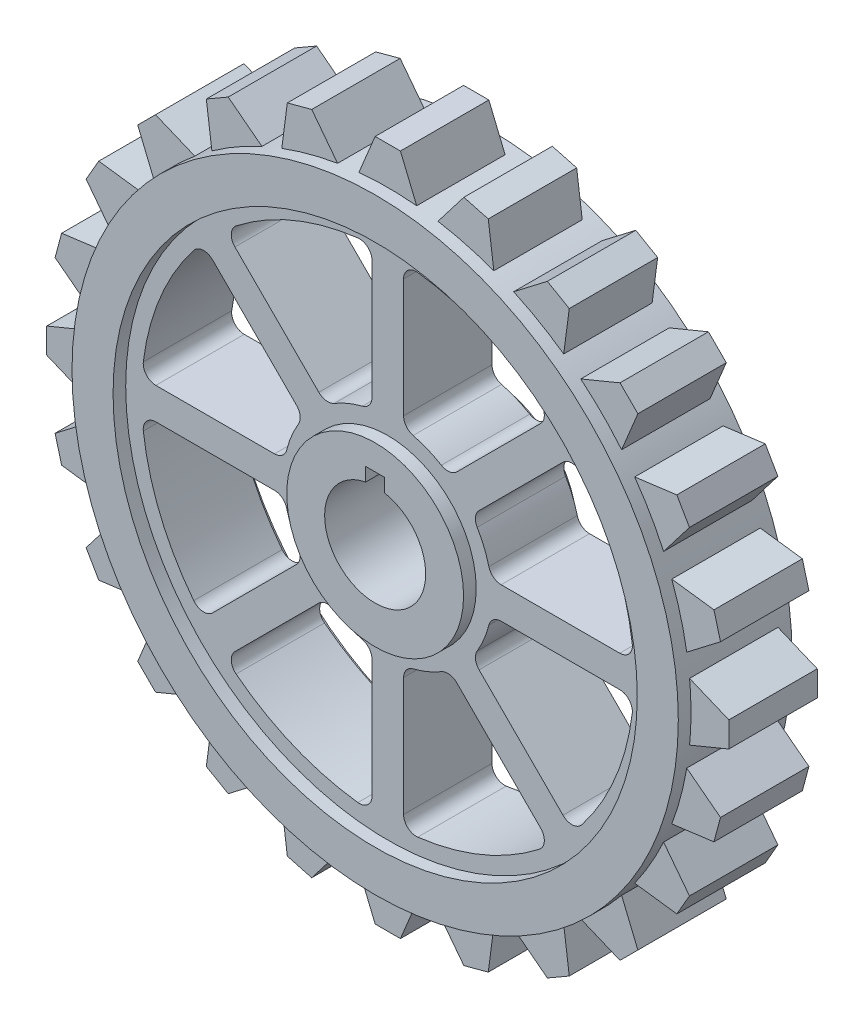
from build123d import *

# Parameters (mm, degrees)
SKETCH1_R           = 48
BOSS_EXTRUDE1_DEPTH = 9
SKETCH2_R           = 41.5
SKETCH2_R_2         = 14
CUT_EXTRUDE1_DEPTH  = 2
CUT_EXTRUDE2_DEPTH  = 70.742383097
CIRPATTERN2_COUNT   = 8
BOSS_EXTRUDE2_DEPTH = 7
CIRPATTERN3_COUNT   = 24


with BuildPart() as part:
    # Sketch1 → Boss-Extrude1 (new, symmetric)
    with BuildSketch(Plane.XY):
        Circle(SKETCH1_R)
        with BuildLine():
            Line((-1.5, 7.858116823), (-1.5, 10))
            Line((-1.5, 10), (1.5, 10))
            Line((1.5, 10), (1.5, 7.858116823))
            ThreePointArc((1.5, 7.858116823), (0, -8), (-1.5, 7.858116823))
        make_face(mode=Mode.SUBTRACT)
    extrude(amount=BOSS_EXTRUDE1_DEPTH, both=True)

    # Sketch2 → Cut-Extrude1 (cut)
    with BuildSketch(Plane.XY.offset(9)):
        Circle(SKETCH2_R)
        Circle(SKETCH2_R_2, mode=Mode.SUBTRACT)
    cut_extrude1 = extrude(amount=-CUT_EXTRUDE1_DEPTH, mode=Mode.SUBTRACT)

    # Mirror1: Cut-Extrude1 across plane
    add(cut_extrude1.mirror(Plane.XY), mode=Mode.SUBTRACT)

    # Sketch3 → Cut-Extrude2 (cut, through all)
    with BuildSketch(Plane.XY.offset(7)):
        with BuildLine():
            Line((-10.920810587, 14.456344493), (-24.200964244, 27.73649815))
            ThreePointArc((-24.200964244, 27.73649815), (-24.7830355, 29.272559678), (-24.018466935, 30.726425859))
            ThreePointArc((-24.018466935, 30.726425859), (-14.924653862, 36.031301768), (-4.743243243, 38.71048493))
            ThreePointArc((-4.743243243, 38.71048493), (-3.174572991, 38.223077911), (-2.5, 36.725331857))
            Line((-2.5, 36.725331857), (-2.5, 17.944358445))
            ThreePointArc((-2.5, 17.944358445), (-2.923140309, 16.714109074), (-4.013513514, 16.004427802))
            ThreePointArc((-4.013513514, 16.004427802), (-6.314276634, 15.244012286), (-8.478856806, 14.15482205))
            ThreePointArc((-8.478856806, 14.15482205), (-9.751687534, 13.885632203), (-10.920810587, 14.456344493))
        make_face()
    cut_extrude2 = extrude(amount=-CUT_EXTRUDE2_DEPTH, mode=Mode.SUBTRACT)

    # CirPattern2: Cut-Extrude2 ×8 about axis
    cirpattern2_axis = Axis((0, 0, 0), (0, 0, 1))
    for i in range(1, CIRPATTERN2_COUNT):
        add(cut_extrude2.rotate(cirpattern2_axis, i * 360 / CIRPATTERN2_COUNT), mode=Mode.SUBTRACT)

    # Sketch5 → Boss-Extrude2 (add, symmetric)
    with BuildSketch(Plane.XY):
        with BuildLine():
            Line((-4.575830228, 47.781395728), (-2, 54))
            Line((-2, 54), (2, 54))
            Line((2, 54), (4.575830228, 47.781395728))
            ThreePointArc((4.575830228, 47.781395728), (0, 48), (-4.575830228, 47.781395728))
        make_face()
    boss_extrude2 = extrude(amount=BOSS_EXTRUDE2_DEPTH, both=True)

    # CirPattern3: Boss-Extrude2 ×24 about axis
    cirpattern3_axis = Axis((0, 0, 0), (0, 0, 1))
    for i in range(1, CIRPATTERN3_COUNT):
        add(boss_extrude2.rotate(cirpattern3_axis, i * 360 / CIRPATTERN3_COUNT))


solid = part.part
